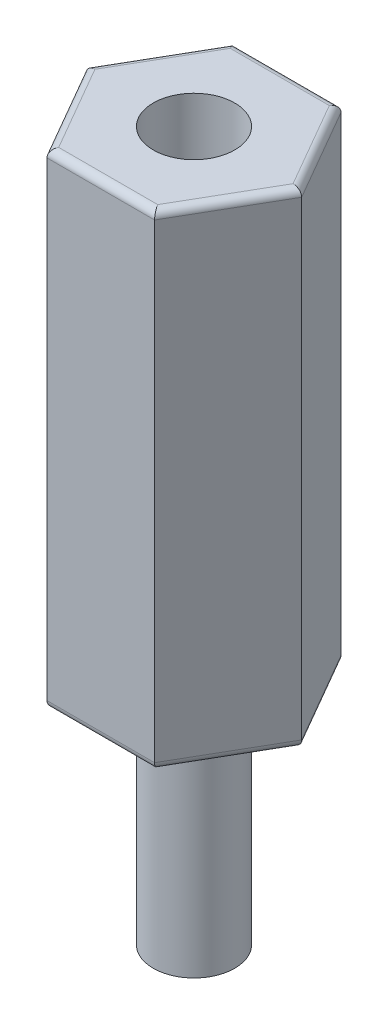
from build123d import *

# Parameters (mm, degrees)
RESSALTO_EXTRUS_O1_DEPTH = 13
FILETE1_R                = 0.2
ESBO_O2_R                = 1.0922
RESSALTO_EXTRUS_O2_DEPTH = 6
ESBO_O3_R                = 1.0922
CORTE_EXTRUS_O1_DEPTH    = 4.76


with BuildPart() as part:
    # Esboço1 → Ressalto-extrusão1 (new body)
    with BuildSketch(Plane(origin=(0, 0, 0), x_dir=(1, 0, 0), z_dir=(0, 1, 0))):
        Polygon((2.886751346, 0), (1.443375673, 2.5), (-1.443375673, 2.5), (-2.886751346, 0), (-1.443375673, -2.5), (1.443375673, -2.5), align=None)
    extrude(amount=RESSALTO_EXTRUS_O1_DEPTH)

    # Filete1
    filete1_edges = [part.edges().sort_by_distance(p)[0] for p in [
        (0, 13, -2.5),
        (-2.165063509, 13, -1.25),
        (-2.165063509, 13, 1.25),
        (0, 13, 2.5),
        (2.165063509, 13, 1.25),
        (0, 0, 2.5),
        (-2.165063509, 0, 1.25),
        (-2.165063509, 0, -1.25),
        (2.165063509, 13, -1.25),
        (0, 0, -2.5),
        (2.165063509, 0, -1.25),
        (2.165063509, 0, 1.25),
    ]]
    fillet(filete1_edges, radius=FILETE1_R)

    # Esboço2 → Ressalto-extrusão2 (add)
    with BuildSketch(Plane.XZ):
        with Locations(Location((0, 0, 0), (0, 0, 90))):
            Circle(ESBO_O2_R)
    extrude(amount=RESSALTO_EXTRUS_O2_DEPTH)

    # Esboço3 → Corte-extrusão1 (cut)
    with BuildSketch(Plane(origin=(0, 13, 0), x_dir=(1, 0, 0), z_dir=(0, 1, 0))):
        with Locations(Location((0, 0, 0), (0, 0, 270))):
            Circle(ESBO_O3_R)
    extrude(amount=-CORTE_EXTRUS_O1_DEPTH, mode=Mode.SUBTRACT)


solid = part.part
